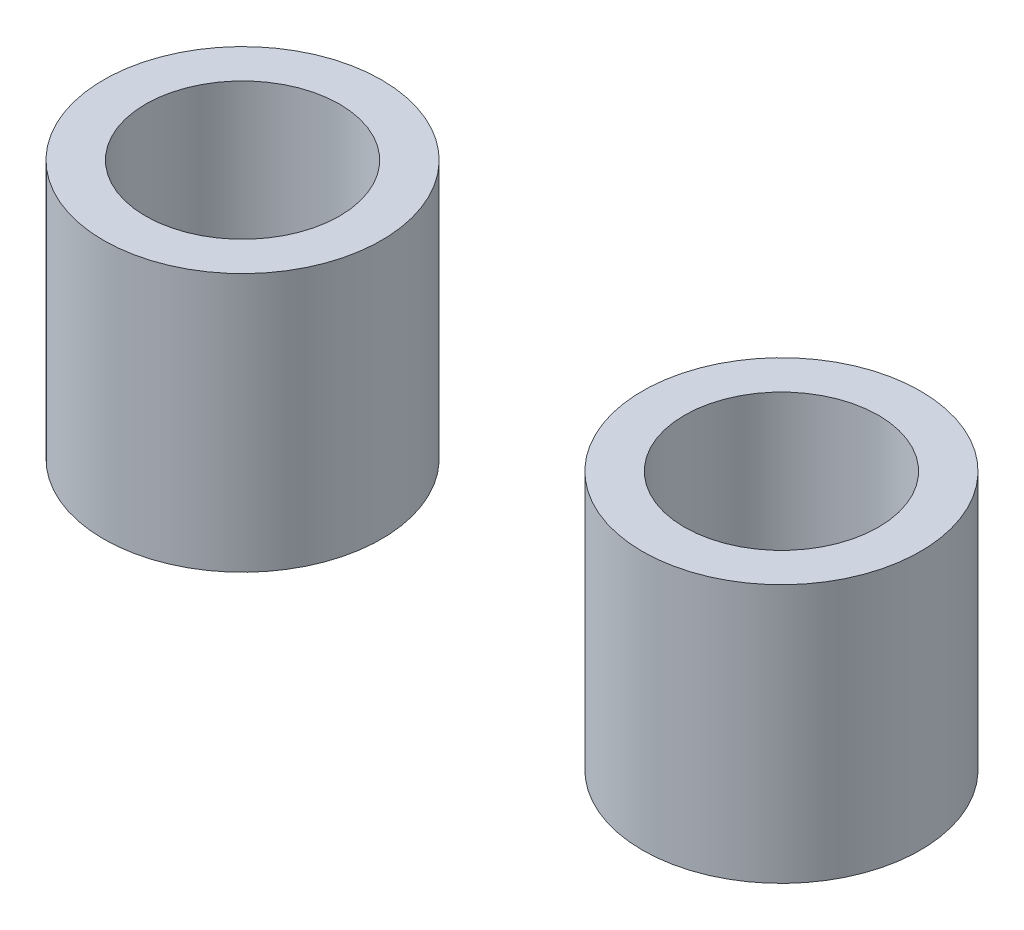
from build123d import *

# Parameters (mm, degrees)
SKETCH1_R             = 1.6383
SKETCH1_R_2           = 1.143
BOSS_EXTRUDE1_DEPTH   = 3.048
BOSS_EXTRUDE1_2_DEPTH = 3.048


with BuildPart() as part:
    # Sketch1 → Boss-Extrude1 (new body)
    with BuildSketch(Plane(origin=(0, 0, 0), x_dir=(1, 0, 0), z_dir=(0, 1, 0))):
        with Locations(Location((6.35, 0, 0), (0, 0, 90))):
            Circle(SKETCH1_R)
        with Locations(Location((6.35, 0, 0), (0, 0, 90))):
            Circle(SKETCH1_R_2, mode=Mode.SUBTRACT)
    extrude(amount=BOSS_EXTRUDE1_DEPTH)


with BuildPart() as body_2:
    # Sketch1 → Boss-Extrude1 2 (new body)
    with BuildSketch(Plane(origin=(0, 0, 0), x_dir=(1, 0, 0), z_dir=(0, 1, 0))):
        with Locations(Location((0, 0, 0), (0, 0, 90))):
            Circle(SKETCH1_R)
        with Locations(Location((0, 0, 0), (0, 0, 90))):
            Circle(SKETCH1_R_2, mode=Mode.SUBTRACT)
    extrude(amount=BOSS_EXTRUDE1_2_DEPTH)


solid = Compound([part.part, body_2.part])
